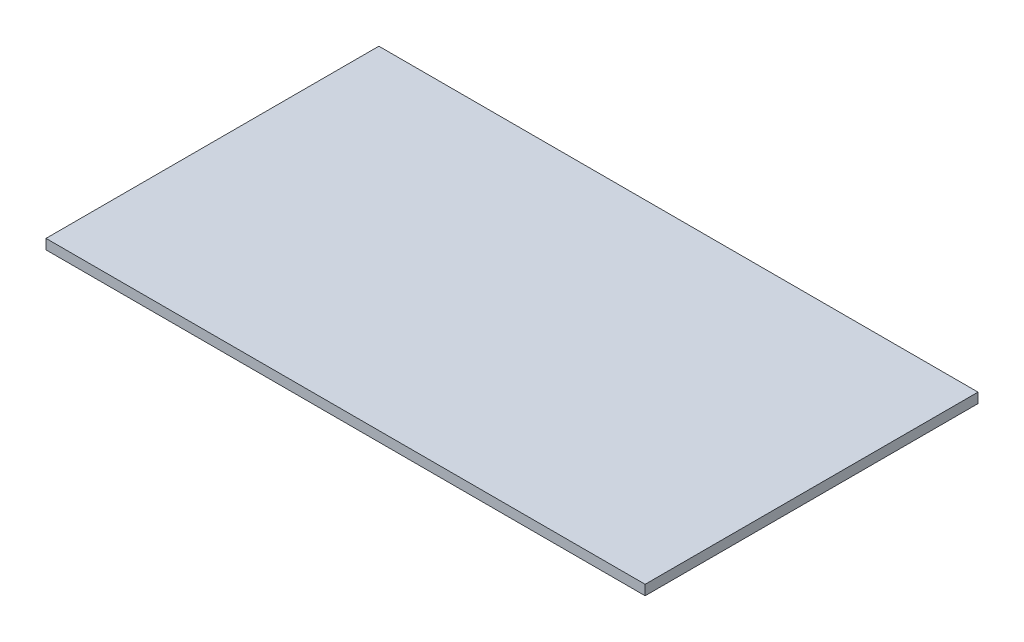
from build123d import *

# Parameters (mm, degrees)
SKETCH1_W           = 1080
SKETCH1_H           = 600
BOSS_EXTRUDE1_DEPTH = 18


with BuildPart() as part:
    # Sketch1 → Boss-Extrude1 (new body)
    with BuildSketch(Plane(origin=(0, 0, 0), x_dir=(1, 0, 0), z_dir=(0, 1, 0))):
        Rectangle(SKETCH1_W, SKETCH1_H)
    extrude(amount=BOSS_EXTRUDE1_DEPTH)


solid = part.part
